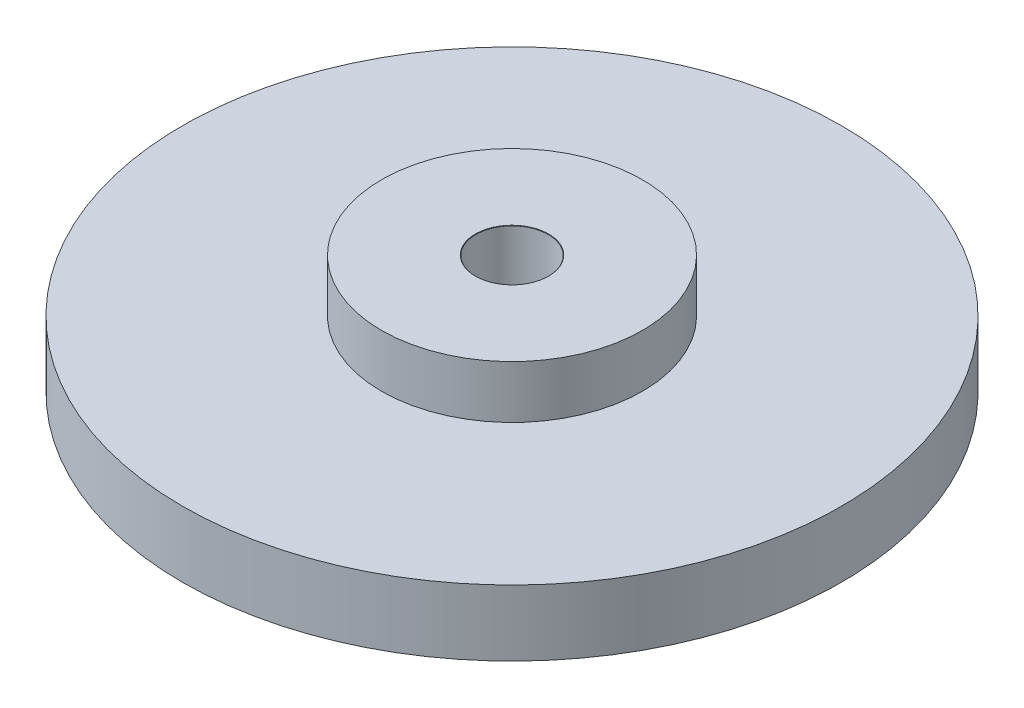
from build123d import *

# Parameters (mm, degrees)
SKETCH1_R                      = 25
BOSS_EXTRUDE1_DEPTH            = 5
SKETCH2_R                      = 9.9
BOSS_EXTRUDE2_DEPTH            = 4
M5_CLEARANCE_HOLE1_D           = 5.5
M5_CLEARANCE_HOLE1_CSINK_D     = 5.55
M5_CLEARANCE_HOLE1_CSINK_ANGLE = 90


with BuildPart() as part:
    # Sketch1 → Boss-Extrude1 (new body)
    with BuildSketch(Plane(origin=(0, 0, 0), x_dir=(1, 0, 0), z_dir=(0, 1, 0))):
        with Locations(Location((0, 0, 0), (0, 0, 270))):
            Circle(SKETCH1_R)
    extrude(amount=BOSS_EXTRUDE1_DEPTH)

    # Sketch2 → Boss-Extrude2 (add)
    with BuildSketch(Plane(origin=(0, 5, 0), x_dir=(1, 0, 0), z_dir=(0, 1, 0))):
        with Locations(Location((0, 0, 0), (0, 0, 270))):
            Circle(SKETCH2_R)
    extrude(amount=BOSS_EXTRUDE2_DEPTH)

    # M5 Clearance Hole1 (through all)
    with Locations(Plane(origin=(0, 9, 0), x_dir=(1, 0, 0), z_dir=(0, 1, 0))):
        with Locations((0, 0)):
            CounterSinkHole(M5_CLEARANCE_HOLE1_D / 2, M5_CLEARANCE_HOLE1_CSINK_D / 2, counter_sink_angle=M5_CLEARANCE_HOLE1_CSINK_ANGLE)


solid = part.part
